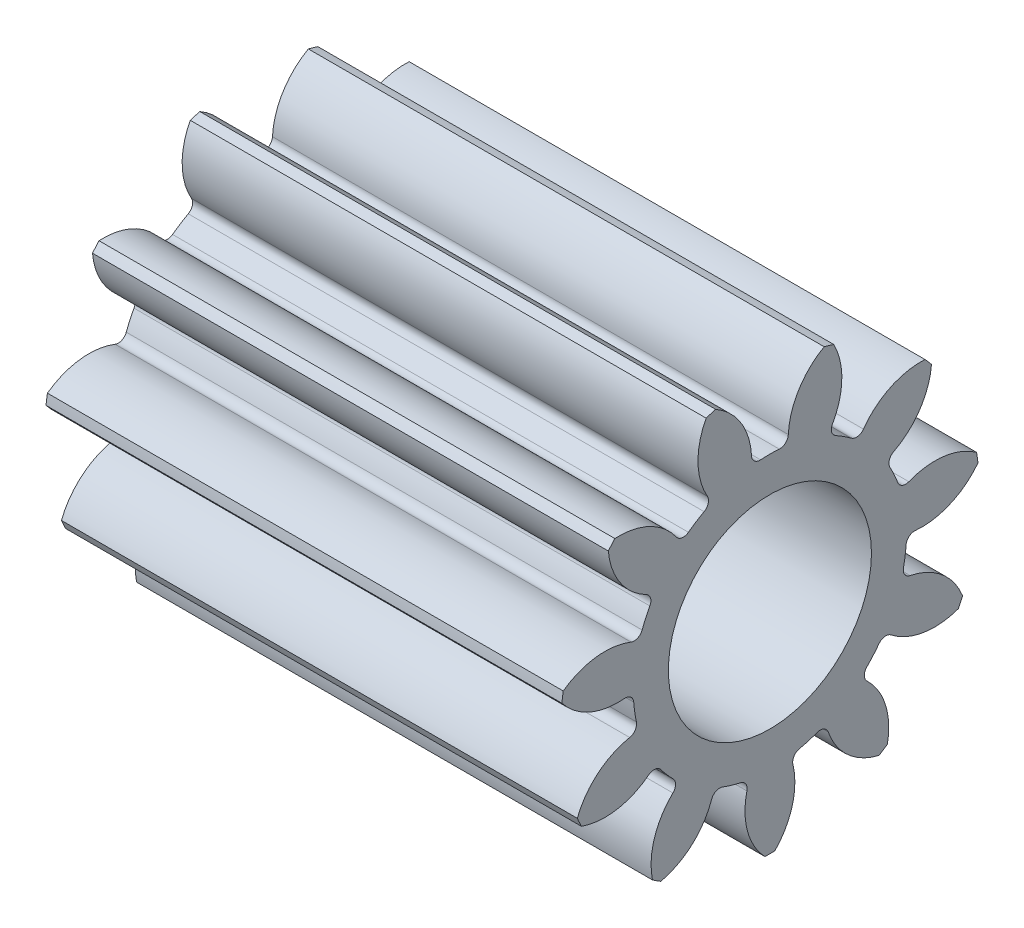
from build123d import *

# Parameters (mm, degrees)
BASPROSKE_W                = 12.7
BASPROSKE_H                = 5.159375
TOOTHCUT_DEPTH             = 15.646784657
ROOTFILLETS_R              = 0.20955
TEETHCUTS_COUNT            = 11
TEETHCUTS_ANGLE            = 327.272727273
ROOTFILLETS_OF_TEETHCUTS_R = 0.20955
CUT_EXTRUDE1_REACH         = 16.634
SKETCH1_R                  = 2.499999953


with BuildPart() as part:
    # BasProSke → Base-Revolve (revolve)
    with BuildSketch(Plane(origin=(0, 0, 0), x_dir=(1, 0, 0), z_dir=(0, 1, 0)), mode=Mode.PRIVATE) as base_revolve_sk:
        with Locations((6.35, 2.5796875)):
            Rectangle(BASPROSKE_W, BASPROSKE_H)
    revolve(base_revolve_sk.sketch.rotate(Axis((-10, 0, 0), (1, 0, 0)), 180), axis=Axis((-10, 0, 0), (1, 0, 0)))

    # TooCutSke → ToothCut (cut, through all)
    with BuildSketch(Plane(origin=(0, 0, 0), x_dir=(0, 0, -1), z_dir=(1, 0, 0))):
        with BuildLine():
            ThreePointArc((0.455692995, 3.331302043), (0, 3.362325), (-0.455692995, 3.331302043))
            ThreePointArc((-0.455692995, 3.331302043), (-0.66414347, 4.301321709), (-1.3673759, 5.001217347))
            ThreePointArc((-1.3673759, 5.001217347), (0, 5.184775), (1.3673759, 5.001217347))
            ThreePointArc((1.3673759, 5.001217347), (0.66414347, 4.301321709), (0.455692995, 3.331302043))
        make_face()
    toothcut = extrude(amount=TOOTHCUT_DEPTH, mode=Mode.SUBTRACT)

    # RootFillets
    rootfillets_edges = [part.edges().sort_by_distance(p)[0] for p in [
        (6.35, 3.331302043, -0.455692995),
        (6.35, 3.331302043, 0.455692995),
    ]]
    fillet(rootfillets_edges, radius=ROOTFILLETS_R)

    # TeethCuts: ToothCut ×11 about axis
    teethcuts_axis = Axis((-10, 0, 0), (1, 0, 0))
    for i in range(1, TEETHCUTS_COUNT):
        add(toothcut.rotate(teethcuts_axis, i * TEETHCUTS_ANGLE / (TEETHCUTS_COUNT - 1)), mode=Mode.SUBTRACT)

    # RootFillets of TeethCuts
    rootfillets_of_teethcuts_edges = [part.edges().sort_by_distance(p)[0] for p in [
        (6.35, 3.048835846, 1.417684518),
        (6.35, 2.556103379, 2.184391201),
        (6.35, 1.798385809, 2.840957213),
        (6.35, 0.969359954, 3.219560636),
        (6.35, -0.023039015, 3.362246066),
        (6.35, -0.925148408, 3.232542317),
        (6.35, -1.837149114, 2.81604555),
        (6.35, -2.525928687, 2.219214652),
        (6.35, -3.067977351, 1.375770469),
        (6.35, -3.324744456, 0.501302016),
        (6.35, -3.324744456, -0.501302016),
        (6.35, -3.067977351, -1.375770469),
        (6.35, -2.525928687, -2.219214652),
        (6.35, -1.837149114, -2.81604555),
        (6.35, -0.925148408, -3.232542317),
        (6.35, -0.023039015, -3.362246066),
        (6.35, 0.969359954, -3.219560636),
        (6.35, 1.798385809, -2.840957213),
        (6.35, 2.556103379, -2.184391201),
        (6.35, 3.048835846, -1.417684518),
    ]]
    fillet(rootfillets_of_teethcuts_edges, radius=ROOTFILLETS_OF_TEETHCUTS_R)

    # Sketch1 → Cut-Extrude1 (cut, up to next)
    with BuildSketch(Plane(origin=(12.7, 0, 0), x_dir=(0, 0, -1), z_dir=(1, 0, 0)), mode=Mode.PRIVATE) as cut_extrude1_sk1:
        Circle(SKETCH1_R)
    cut_extrude1_tool1 = extrude(cut_extrude1_sk1.sketch, amount=-CUT_EXTRUDE1_REACH, mode=Mode.PRIVATE) & part.part
    add(cut_extrude1_tool1.solids().sort_by_distance((12.7, 0, 0))[0], mode=Mode.SUBTRACT)


solid = part.part
